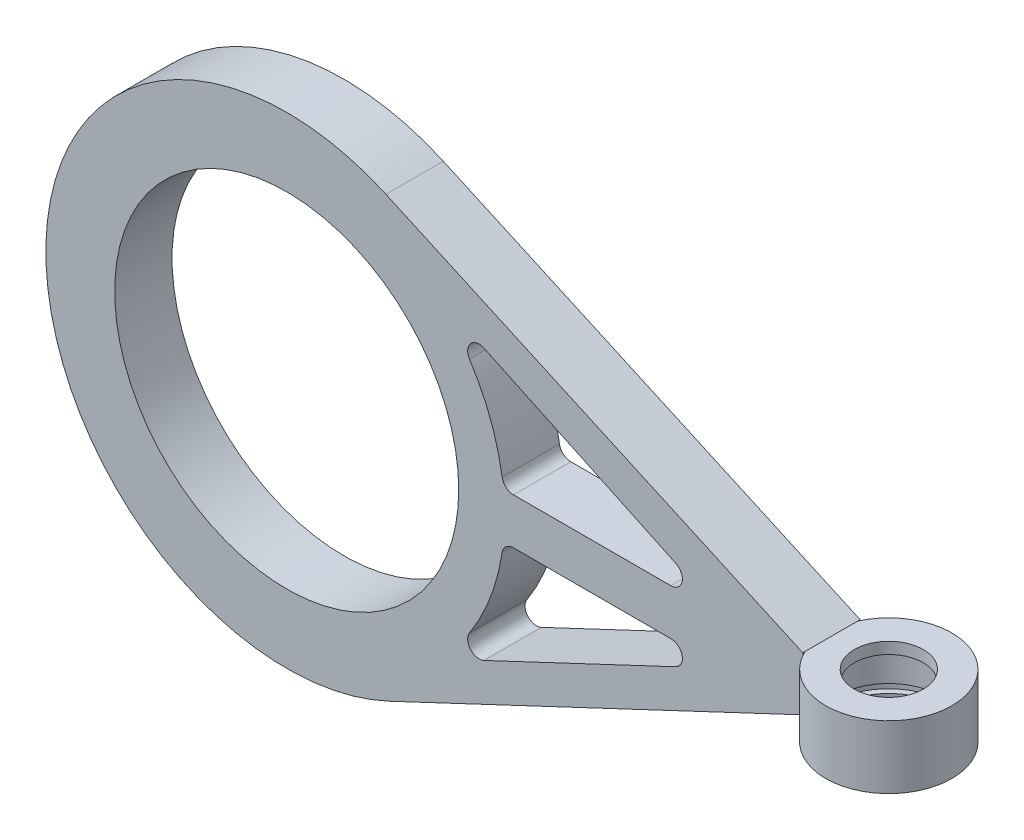
from build123d import *

# Parameters (mm, degrees)
SKETCH_1_R          = 42
EXTRUDE_1_DEPTH     = 5
SKETCH_2_W          = 11
SKETCH_2_H          = 11
EXTRUDE_2_DEPTH     = 5
SKETCH_4_R          = 6
CUT_EXTRUDE_1_DEPTH = 25
SKETCH_5_R          = 9
CUT_EXTRUDE_2_DEPTH = 9
CUT_EXTRUDE_START   = 8
SKETCH_6_R          = 10
SKETCH_6_R_2        = 9
CUT_EXTRUDE_3_DEPTH = 1.5
SKETCH_7_R          = 30
CUT_EXTRUDE_4_DEPTH = 30
FILLET_1_R          = 2


with BuildPart() as part:
    # 草图1 → 凸台-拉伸1 (new body)
    with BuildSketch(Plane.XY):
        Circle(SKETCH_1_R)
    extrude(amount=EXTRUDE_1_DEPTH)



with BuildPart() as body_2:
    # 草图2 → 旋转1 (revolve)
    with BuildSketch(Plane.XY.offset(5), mode=Mode.PRIVATE) as revolve_1_sk:
        with Locations((94.5, -0.125)):
            Rectangle(SKETCH_2_W, SKETCH_2_H)
    revolve(revolve_1_sk.sketch.rotate(Axis((100, 22.717290725, 5), (0, -1, 0)), 270), axis=Axis((100, 22.717290725, 5), (0, -1, 0)))


with BuildPart() as part_1:
    add(part.part)

    add(body_2.part)  # 凸台-拉伸2 merges body 2
    # 草图3 → 凸台-拉伸2 (add, symmetric)
    with BuildSketch(Plane.XY.offset(5)):
        with BuildLine():
            Line((17.314737244, 38.264864748), (90, 5.375))
            Line((90, 5.375), (90, -4))
            Line((90, -4), (17.911593748, -37.989140678))
            ThreePointArc((17.911593748, -37.989140678), (-41.998713488, -0.328732965), (17.314737244, 38.264864748))
        make_face()
    extrude(amount=EXTRUDE_2_DEPTH, both=True)

    # 草图4 → 切除-拉伸1 (cut)
    with BuildSketch(Plane.XZ.offset(5.625)):
        with Locations(Location((100, 5, 0), (0, 0, 270))):
            Circle(SKETCH_4_R)
    extrude(amount=-CUT_EXTRUDE_1_DEPTH, mode=Mode.SUBTRACT)

    # 草图5 → 切除-拉伸2 (cut)
    with BuildSketch(Plane.XZ.offset(5.625)):
        with Locations(Location((100, 5, 0), (0, 0, 270))):
            Circle(SKETCH_5_R)
    extrude(amount=-CUT_EXTRUDE_2_DEPTH, mode=Mode.SUBTRACT)

    # 草图6 → 切除-拉伸3 (cut)
    # profile 1 of 2: a face of its own
    with BuildSketch(Plane.XZ.offset(-3.375).offset(CUT_EXTRUDE_START)):
        with Locations(Location((100, 5, 0), (0, 0, 270))):
            Circle(SKETCH_6_R)
        with Locations(Location((100, 5, 0), (0, 0, 270))):
            Circle(SKETCH_6_R_2, mode=Mode.SUBTRACT)
    # profile 2 of 2: a face of its own
    with BuildSketch(Plane.XZ.offset(-3.375).offset(CUT_EXTRUDE_START)):
        with Locations(Location((100, 5, 0), (0, 0, 270))):
            Circle(SKETCH_6_R_2)
    extrude(amount=-CUT_EXTRUDE_3_DEPTH, mode=Mode.SUBTRACT)

    # 草图7 → 切除-拉伸4 (cut)
    with BuildSketch(Plane.XY.offset(10)):
        Circle(SKETCH_7_R)
        with BuildLine():
            Line((26.356552806, -27.373931471), (75.930900201, -4))
            Line((75.930900201, -4), (37.788887255, -4))
            ThreePointArc((37.788887255, -4), (34.135678377, -16.695971422), (26.356552806, -27.373931471))
        make_face()
        with BuildLine():
            Line((37.788887255, 4), (75.930900201, 4))
            Line((75.930900201, 4), (26.356552806, 27.373931471))
            ThreePointArc((26.356552806, 27.373931471), (34.135678377, 16.695971422), (37.788887255, 4))
        make_face()
    extrude(amount=-CUT_EXTRUDE_4_DEPTH, mode=Mode.SUBTRACT)

    # 圆角1
    fillet_1_edges = [part_1.edges().sort_by_distance(p)[0] for p in [
        (37.788887255, 4, 5),
        (26.356552806, 27.373931471, 5),
        (75.930900201, 4, 5),
        (26.356552806, -27.373931471, 5),
        (37.788887255, -4, 5),
        (75.930900201, -4, 5),
    ]]
    fillet(fillet_1_edges, radius=FILLET_1_R)


solid = part_1.part
